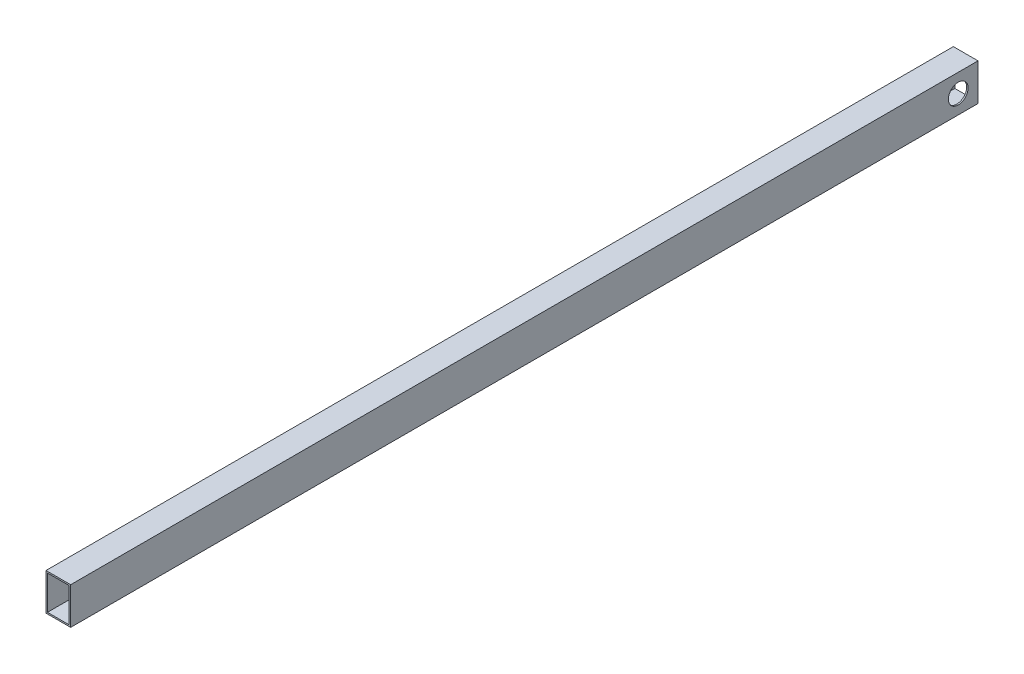
from build123d import *

# Parameters (mm, degrees)
BOSS_EXTRUDE1_DEPTH      = 3600
BOSS_EXTRUDE1_DEPTH_BACK = 80
SKETCH1_W                = 100
SKETCH1_H                = 150
SKETCH1_W_2              = 88
SKETCH1_H_2              = 138
CUT_EXTRUDE1_DEPTH       = 3602.12829541
CUT_EXTRUDE1_DEPTH_BACK  = 3602.12829541
SKETCH2_R                = 40


with BuildPart() as part:
    # Sketch1 → Boss-Extrude1 (new, two sides: drawn at the far end of the back side and taken through both)
    with BuildSketch(Plane.XY.offset(-BOSS_EXTRUDE1_DEPTH_BACK)):
        Rectangle(SKETCH1_W, SKETCH1_H)
        Rectangle(SKETCH1_W_2, SKETCH1_H_2, mode=Mode.SUBTRACT)
    extrude(amount=BOSS_EXTRUDE1_DEPTH + BOSS_EXTRUDE1_DEPTH_BACK)

    # Sketch2 → Cut-Extrude1 (cut, two sides: drawn at the far end of the back side and taken through both)
    with BuildSketch(Plane(origin=(0, 0, 0), x_dir=(0, 0, -1), z_dir=(1, 0, 0)).offset(-CUT_EXTRUDE1_DEPTH_BACK)):
        Circle(SKETCH2_R)
    extrude(amount=CUT_EXTRUDE1_DEPTH + CUT_EXTRUDE1_DEPTH_BACK, mode=Mode.SUBTRACT)


solid = part.part
